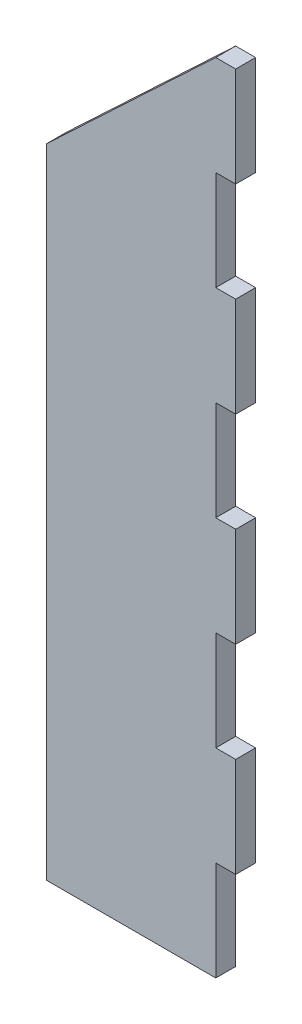
from build123d import *

# Parameters (mm, degrees)
BOSS_EXTRUDE1_DEPTH = 6.35
SKETCH2_W           = 12.7
SKETCH2_H           = 6.35
CUT_EXTRUDE1_DEPTH  = 6.35


with BuildPart() as part:
    # Sketch1 → Boss-Extrude1 (new body)
    with BuildSketch(Plane.XY):
        Polygon((-26.9875, -101.6), (14.2875, -101.6), (14.2875, -107.95), (26.9875, -107.95), (26.9875, -69.85), (33.3375, -69.85), (33.3375, -38.1), (26.9875, -38.1), (26.9875, -6.35), (33.3375, -6.35), (33.3375, 25.4), (26.9875, 25.4), (26.9875, 57.15), (33.3375, 57.15), (33.3375, 88.9), (26.9875, 88.9), (26.9875, 120.65), (33.3375, 120.65), (33.3375, 152.4), (26.9875, 152.4), (-26.9875, 101.6), align=None)
    extrude(amount=BOSS_EXTRUDE1_DEPTH)

    # Sketch2 → Cut-Extrude1 (cut)
    with BuildSketch(Plane(origin=(0, 0, 0), x_dir=(-1, 0, 0), z_dir=(0, 0, -1))):
        with Locations((-20.6375, -104.775)):
            Rectangle(SKETCH2_W, SKETCH2_H)
    extrude(amount=-CUT_EXTRUDE1_DEPTH, mode=Mode.SUBTRACT)


solid = part.part
